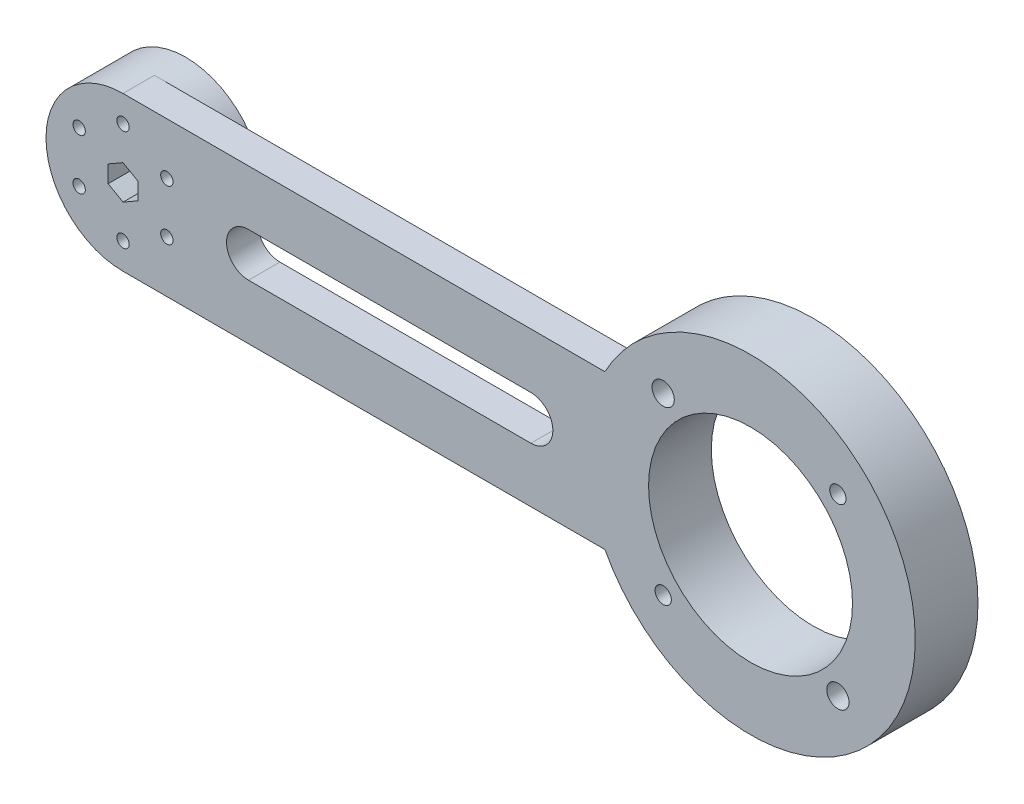
from build123d import *

# Parameters (mm, degrees)
SKETCH1_R           = 1.65
SKETCH1_R_2         = 2.25
SKETCH1_R_3         = 20.6375
SKETCH1_R_4         = 1.25
BOSS_EXTRUDE1_DEPTH = 6.35
BOSS_EXTRUDE2_START = -6.35
SKETCH1_3_R         = 15.584715873
SKETCH1_3_R_2       = 1.25
SKETCH1_3_R_3       = 33.3375
SKETCH1_3_R_4       = 1.65
SKETCH1_3_R_5       = 2.25
SKETCH1_3_R_6       = 20.6375
BOSS_EXTRUDE2_DEPTH = 6.35


with BuildPart() as part:
    # Sketch1 → Boss-Extrude1 (new body)
    with BuildSketch(Plane.XY):
        with BuildLine():
            Line((21.162931467, 15.198561829), (-76.366650528, 15.198561829))
            ThreePointArc((-76.366650528, 15.198561829), (-91.951366401, -0.386154045), (-76.366650528, -15.970869918))
            Line((-76.366650528, -15.970869918), (21.162931467, -15.970869918))
            ThreePointArc((21.162931467, -15.970869918), (83.970849472, -0.386154045), (21.162931467, 15.198561829))
        make_face()
        with BuildLine():
            ThreePointArc((-50.966650528, -4.831154045), (-55.411650528, -0.386154045), (-50.966650528, 4.058845955))
            Line((-50.966650528, 4.058845955), (6.183349472, 4.058845955))
            ThreePointArc((6.183349472, 4.058845955), (10.628349472, -0.386154045), (6.183349472, -4.831154045))
            Line((6.183349472, -4.831154045), (-50.966650528, -4.831154045))
        make_face(mode=Mode.SUBTRACT)
        with Locations((68.311019002, 17.291515485)):
            Circle(SKETCH1_R, mode=Mode.SUBTRACT)
        with Locations((32.955679943, -18.063823575)):
            Circle(SKETCH1_R, mode=Mode.SUBTRACT)
        with Locations((68.311019002, -18.063823575)):
            Circle(SKETCH1_R_2, mode=Mode.SUBTRACT)
        with Locations((50.633349472, -0.386154045)):
            Circle(SKETCH1_R_3, mode=Mode.SUBTRACT)
        with Locations((32.955679943, 17.291515485)):
            Circle(SKETCH1_R_2, mode=Mode.SUBTRACT)
        with Locations((-67.489890139, 4.738845955)):
            Circle(SKETCH1_R_4, mode=Mode.SUBTRACT)
        with Locations((-76.366650528, 9.863845955)):
            Circle(SKETCH1_R_4, mode=Mode.SUBTRACT)
        with Locations((-76.366650528, -10.636154045)):
            Circle(SKETCH1_R_4, mode=Mode.SUBTRACT)
        with Locations((-85.243410916, -5.511154045)):
            Circle(SKETCH1_R_4, mode=Mode.SUBTRACT)
        Polygon((-79.366650528, 1.345896763), (-76.366650528, 3.07794757), (-73.366650528, 1.345896763), (-73.366650528, -2.118204852), (-76.366650528, -3.85025566), (-79.366650528, -2.118204852), align=None, mode=Mode.SUBTRACT)
        with Locations((-67.489890139, -5.511154045)):
            Circle(SKETCH1_R_4, mode=Mode.SUBTRACT)
        with Locations((-85.243410916, 4.738845955)):
            Circle(SKETCH1_R_4, mode=Mode.SUBTRACT)
    extrude(amount=BOSS_EXTRUDE1_DEPTH)

    # Sketch1<3> → Boss-Extrude2 (add)
    # profile 1 of 2: a face of its own
    with BuildSketch(Plane.XY.offset(BOSS_EXTRUDE2_START)):
        with Locations((-76.366650528, -0.386154045)):
            Circle(SKETCH1_3_R)
        with Locations((-76.366650528, -10.636154045)):
            Circle(SKETCH1_3_R_2, mode=Mode.SUBTRACT)
        with Locations((-85.243410916, -5.511154045)):
            Circle(SKETCH1_3_R_2, mode=Mode.SUBTRACT)
        Polygon((-79.366650528, 1.345896763), (-76.366650528, 3.07794757), (-73.366650528, 1.345896763), (-73.366650528, -2.118204852), (-76.366650528, -3.85025566), (-79.366650528, -2.118204852), align=None, mode=Mode.SUBTRACT)
        with Locations((-67.489890139, -5.511154045)):
            Circle(SKETCH1_3_R_2, mode=Mode.SUBTRACT)
        with Locations((-85.243410916, 4.738845955)):
            Circle(SKETCH1_3_R_2, mode=Mode.SUBTRACT)
        with Locations((-67.489890139, 4.738845955)):
            Circle(SKETCH1_3_R_2, mode=Mode.SUBTRACT)
        with Locations((-76.366650528, 9.863845955)):
            Circle(SKETCH1_3_R_2, mode=Mode.SUBTRACT)
    # profile 2 of 2: a face of its own
    with BuildSketch(Plane.XY.offset(BOSS_EXTRUDE2_START)):
        with Locations((50.633349472, -0.386154045)):
            Circle(SKETCH1_3_R_3)
        with Locations((32.955679943, -18.063823575)):
            Circle(SKETCH1_3_R_4, mode=Mode.SUBTRACT)
        with Locations((68.311019002, -18.063823575)):
            Circle(SKETCH1_3_R_5, mode=Mode.SUBTRACT)
        with Locations((50.633349472, -0.386154045)):
            Circle(SKETCH1_3_R_6, mode=Mode.SUBTRACT)
        with Locations((32.955679943, 17.291515485)):
            Circle(SKETCH1_3_R_5, mode=Mode.SUBTRACT)
        with Locations((68.311019002, 17.291515485)):
            Circle(SKETCH1_3_R_4, mode=Mode.SUBTRACT)
    extrude(amount=BOSS_EXTRUDE2_DEPTH)


solid = part.part
